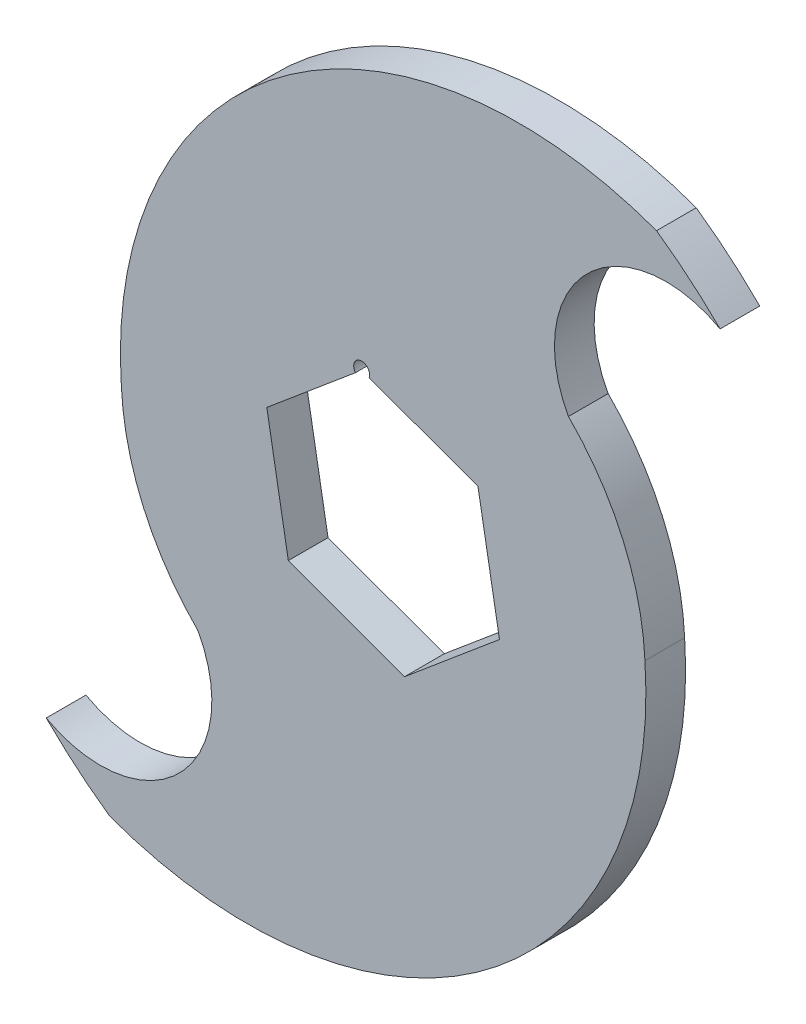
from build123d import *

# Parameters (mm, degrees)
BOSS_EXTRUDE1_DEPTH = 2.5


with BuildPart() as part:
    # Model → Boss-Extrude1 (new, symmetric)
    with BuildSketch(Plane.XY):
        with BuildLine():
            ThreePointArc((625.600029607, 115.214424851), (578.127821467, 108.213195948), (558.208452339, 64.557194238))
            ThreePointArc((558.208452339, 64.557194238), (560.983849767, 52.747710067), (567.839069353, 42.739078209))
            ThreePointArc((567.839069353, 42.739078209), (565.492156458, 25.994108012), (548.747186261, 23.647195117))
            ThreePointArc((548.747186261, 23.647195117), (552.600795358, 20.115585583), (556.747156658, 16.932779125))
            ThreePointArc((556.747156658, 16.932779125), (604.219364798, 23.934008028), (624.138733926, 67.590009739))
            ThreePointArc((624.138733926, 67.590009739), (621.363336499, 79.399493909), (614.508116912, 89.408125767))
            ThreePointArc((614.508116912, 89.408125767), (616.855029807, 106.153095964), (633.600000004, 108.500008859))
            ThreePointArc((633.600000004, 108.500008859), (629.746390907, 112.031618393), (625.600029607, 115.214424851))
        make_face()
        with BuildLine():
            Line((603.1150442, 76.093669174), (589.406378556, 81.08321542))
            ThreePointArc((589.406378556, 81.08321542), (588.293037758, 82.410043316), (587.700641492, 80.782447954))
            Line((587.700641492, 80.782447954), (576.525234868, 71.405168377))
            Line((576.525234868, 71.405168377), (579.232142066, 56.053534802))
            Line((579.232142066, 56.053534802), (593.88050033, 50.721968413))
            Line((593.88050033, 50.721968413), (605.821951397, 60.742035599))
            Line((605.821951397, 60.742035599), (603.1150442, 76.093669174))
        make_face(mode=Mode.SUBTRACT)
    extrude(amount=BOSS_EXTRUDE1_DEPTH, both=True)


solid = part.part
